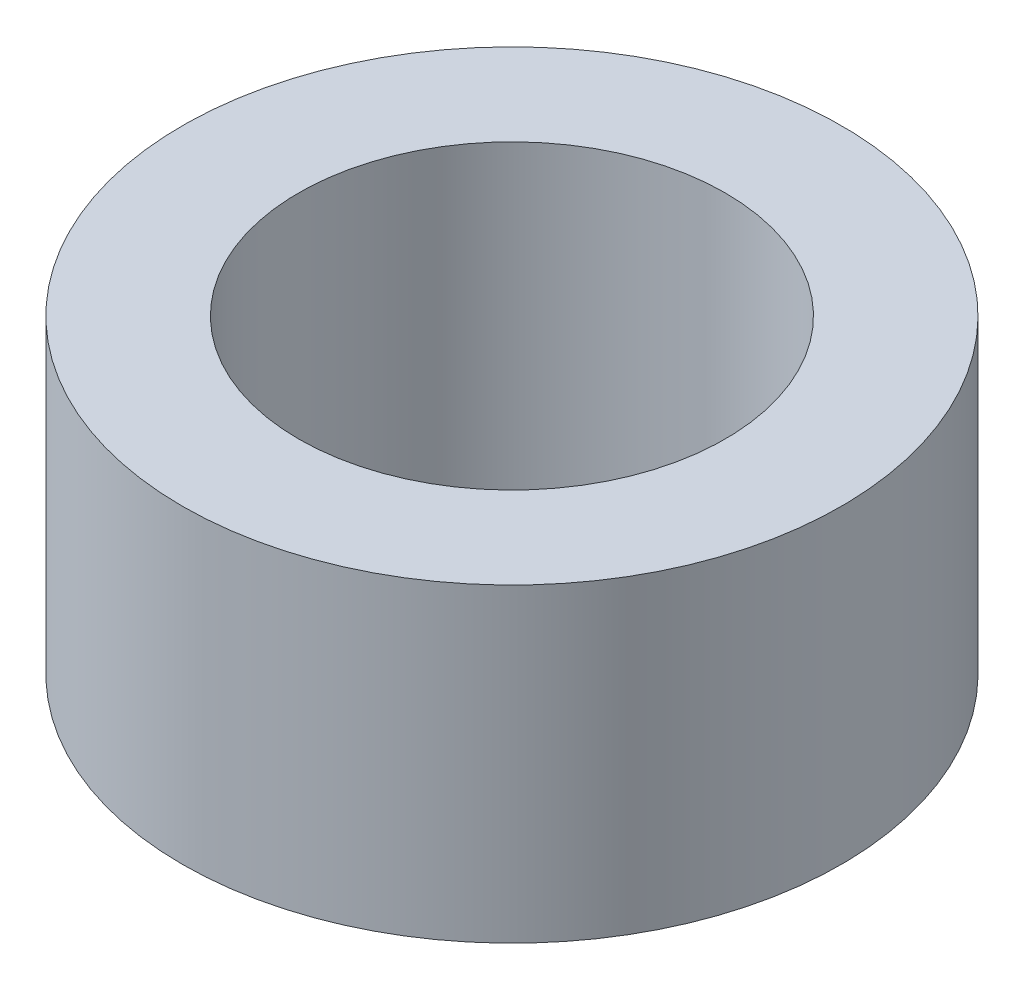
from build123d import *

# Parameters (mm, degrees)
SKETCH1_R           = 4.25
SKETCH1_R_2         = 2.75
BOSS_EXTRUDE1_DEPTH = 4


with BuildPart() as part:
    # Sketch1 → Boss-Extrude1 (new body)
    with BuildSketch(Plane(origin=(0, 0, 0), x_dir=(1, 0, 0), z_dir=(0, 1, 0))):
        with Locations(Location((0, 0, 0), (0, 0, 270))):
            Circle(SKETCH1_R)
        with Locations(Location((0, 0, 0), (0, 0, 270))):
            Circle(SKETCH1_R_2, mode=Mode.SUBTRACT)
    extrude(amount=BOSS_EXTRUDE1_DEPTH)


solid = part.part
